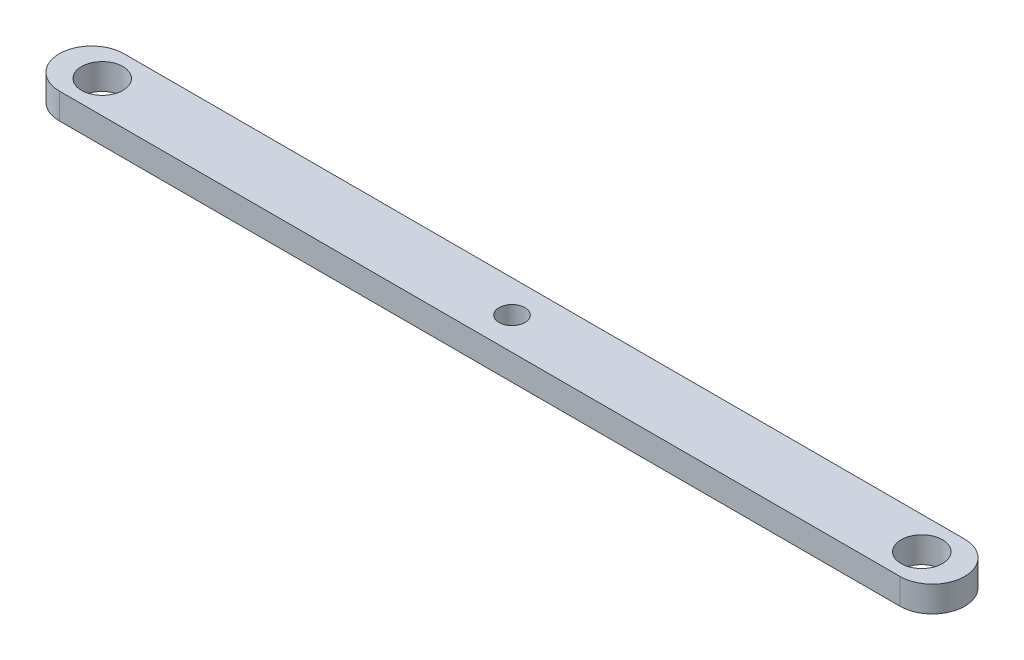
from build123d import *

# Parameters (mm, degrees)
SKETCH1_W               = 70
SKETCH1_H               = 5
BOSS_EXTRUDE1_DEPTH     = 2
CUT_EXTRUDE1_DEPTH      = 71.206837274
CUT_EXTRUDE1_DEPTH_BACK = 71.206837274
SKETCH2_R               = 1.6
CUT_EXTRUDE2_REACH      = 72.207
SKETCH4_R               = 1
FILLET2_RADIUS          = 2.5
FILLET2_LENGTH          = 2
FILLET3_RADIUS          = 2.5
FILLET3_LENGTH          = 2


with BuildPart() as part:
    # Sketch1 → Boss-Extrude1 (new body)
    with BuildSketch(Plane(origin=(0, 0, 0), x_dir=(1, 0, 0), z_dir=(0, 1, 0))):
        with Locations((35, 2.5)):
            Rectangle(SKETCH1_W, SKETCH1_H)
    extrude(amount=BOSS_EXTRUDE1_DEPTH)

    # Sketch2 → Cut-Extrude1 (cut, two sides: drawn at the far end of the back side and taken through both)
    with BuildSketch(Plane(origin=(0, 2, 0), x_dir=(1, 0, 0), z_dir=(0, 1, 0)).offset(-CUT_EXTRUDE1_DEPTH_BACK)):
        with Locations(Location((66.682907, 2.5, 0), (0, 0, 270))):
            Circle(SKETCH2_R)
        with Locations(Location((3.317093, 2.5, 0), (0, 0, 270))):
            Circle(SKETCH2_R)
    extrude(amount=CUT_EXTRUDE1_DEPTH + CUT_EXTRUDE1_DEPTH_BACK, mode=Mode.SUBTRACT)

    # Sketch4 → Cut-Extrude2 (cut, up to next)
    with BuildSketch(Plane(origin=(0, 2, 0), x_dir=(1, 0, 0), z_dir=(0, 1, 0)), mode=Mode.PRIVATE) as cut_extrude2_sk1:
        with Locations(Location((35, 2.5, 0), (0, 0, 270))):
            Circle(SKETCH4_R)
    cut_extrude2_tool1 = extrude(cut_extrude2_sk1.sketch, amount=-CUT_EXTRUDE2_REACH, mode=Mode.PRIVATE) & part.part
    add(cut_extrude2_tool1.solids().sort_by_distance((35, 2, -2.5))[0], mode=Mode.SUBTRACT)

    # Fillet2: full round fillet: the end face becomes a half cylinder, R = half its width
    fillet2_face = Plane((0, 1, -2.5), x_dir=(0, -1, 0), z_dir=(-1, 0, 0))  # on the end face: x along it, z out of the body
    fillet2_slab = fillet2_face.offset(-FILLET2_RADIUS / 2) * Box(FILLET2_LENGTH, 2 * FILLET2_RADIUS, FILLET2_RADIUS, mode=Mode.PRIVATE)  # the body's end, R deep
    fillet2_round = Plane((2.5, 1, -2.5), x_dir=(-1, 0, 0), z_dir=(0, -1, 0)) * Cylinder(FILLET2_RADIUS, FILLET2_LENGTH, mode=Mode.PRIVATE)  # its axis R under the face
    add(fillet2_slab - fillet2_round, mode=Mode.SUBTRACT)

    # Fillet3: full round fillet: the end face becomes a half cylinder, R = half its width
    fillet3_face = Plane((70, 1, -2.5), x_dir=(0, 1, 0), z_dir=(1, 0, 0))  # on the end face: x along it, z out of the body
    fillet3_slab = fillet3_face.offset(-FILLET3_RADIUS / 2) * Box(FILLET3_LENGTH, 2 * FILLET3_RADIUS, FILLET3_RADIUS, mode=Mode.PRIVATE)  # the body's end, R deep
    fillet3_round = Plane((67.5, 1, -2.5), x_dir=(1, 0, 0), z_dir=(0, 1, 0)) * Cylinder(FILLET3_RADIUS, FILLET3_LENGTH, mode=Mode.PRIVATE)  # its axis R under the face
    add(fillet3_slab - fillet3_round, mode=Mode.SUBTRACT)


solid = part.part
